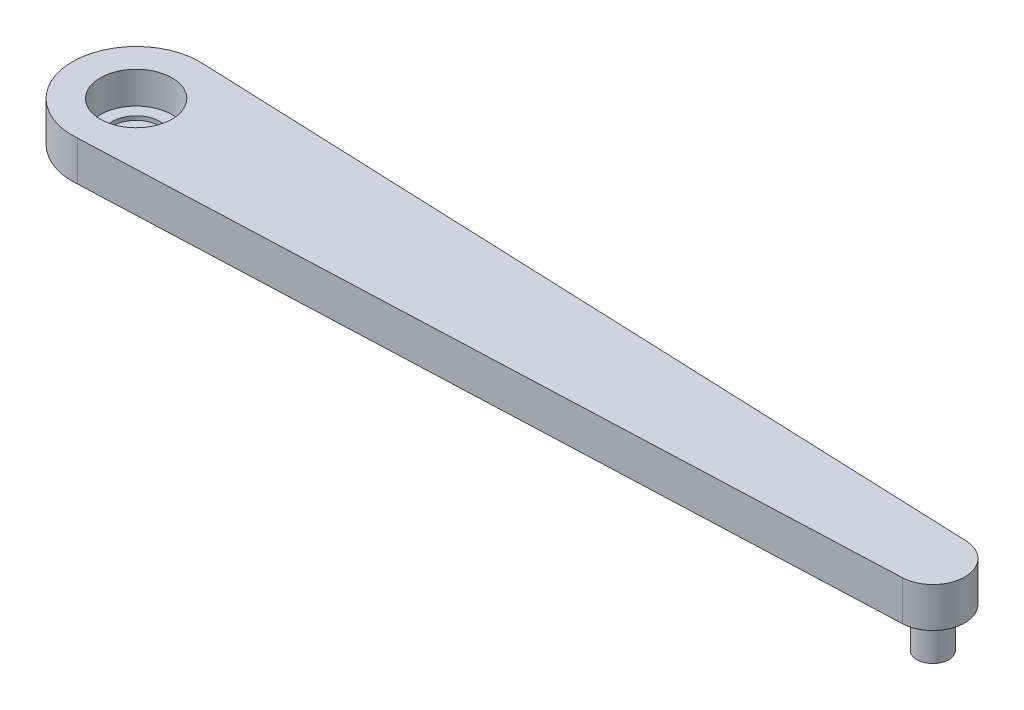
from build123d import *

# Parameters (mm, degrees)
BOSS_EXTRUDE1_DEPTH   = 5
SKETCH2_R             = 4.5
CUT_EXTRUDE1_DEPTH    = 4
SKETCH7_R             = 3
CUT_EXTRUDE3_DEPTH    = 0.5
BODY_MOVE_COPY1_ANGLE = 90
BODY_MOVE_COPY2_ANGLE = 180
SKETCH8_R             = 2.5
BOSS_EXTRUDE2_DEPTH   = 5
CUT_EXTRUDE4_START    = -4
SKETCH9_R             = 2.5
SKETCH9_R_2           = 2
CUT_EXTRUDE4_DEPTH    = 4


with BuildPart() as part:
    # Sketch1 → Boss-Extrude1 (new body)
    with BuildSketch(Plane.XY):
        with BuildLine():
            Line((100.159744623, 3.998531964), (0.638194143, 7.974499314))
            ThreePointArc((0.638194143, 7.974499314), (-7.999995692, 0), (0.638194143, -7.974499314))
            Line((0.638194143, -7.974499314), (100.159744623, -3.998531964))
            ThreePointArc((100.159744623, -3.998531964), (104.001721656, 0), (100.159744623, 3.998531964))
        make_face()
    extrude(amount=BOSS_EXTRUDE1_DEPTH)

    # Sketch2 → Cut-Extrude1 (cut)
    with BuildSketch(Plane(origin=(0, 0, 0), x_dir=(-1, 0, 0), z_dir=(0, 0, -1))):
        Circle(SKETCH2_R)
    extrude(amount=-CUT_EXTRUDE1_DEPTH, mode=Mode.SUBTRACT)

    # Sketch7 → Cut-Extrude3 (cut)
    with BuildSketch(Plane(origin=(0, 0, 4), x_dir=(-1, 0, 0), z_dir=(0, 0, -1))):
        Circle(SKETCH7_R)
    extrude(amount=-CUT_EXTRUDE3_DEPTH, mode=Mode.SUBTRACT)


with BuildPart() as part_1:
    # Body-Move/Copy1: moved
    add(part.part.rotate(Axis((0, 0, 11), (-1, 0, 0)), BODY_MOVE_COPY1_ANGLE))


with BuildPart() as part_2:
    # Body-Move/Copy2: moved
    add(part_1.part.rotate(Axis((0, -8, 11), (1, 0, 0)), BODY_MOVE_COPY2_ANGLE))

    # Sketch8 → Boss-Extrude2 (add)
    with BuildSketch(Plane.XZ.offset(10)):
        with Locations((100, 11)):
            Circle(SKETCH8_R)
    extrude(amount=BOSS_EXTRUDE2_DEPTH)

    # Sketch9 → Cut-Extrude4 (cut)
    with BuildSketch(Plane.XZ.offset(15).offset(CUT_EXTRUDE4_START)):
        with Locations((100, 11)):
            Circle(SKETCH9_R)
        with Locations((100, 11)):
            Circle(SKETCH9_R_2, mode=Mode.SUBTRACT)
    extrude(amount=CUT_EXTRUDE4_DEPTH, mode=Mode.SUBTRACT)


solid = part_2.part
